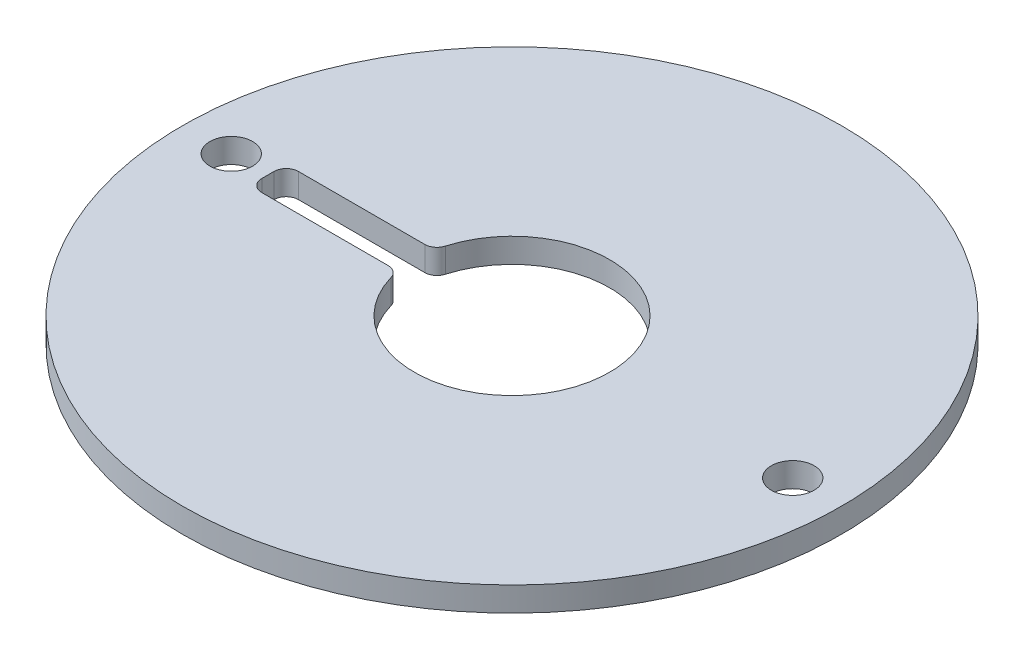
from build123d import *

# Parameters (mm, degrees)
SKETCH1_R           = 27
SKETCH1_R_2         = 8
SKETCH1_R_3         = 1.75
BOSS_EXTRUDE1_DEPTH = 2
SKETCH2_W           = 15
SKETCH2_H           = 3
CUT_EXTRUDE1_DEPTH  = 39.236108589
FILLET1_R           = 1


with BuildPart() as part:
    # Sketch1 → Boss-Extrude1 (new body)
    with BuildSketch(Plane(origin=(0, 0, 0), x_dir=(1, 0, 0), z_dir=(0, 1, 0))):
        with Locations(Location((0, 0, 0), (0, 0, 270))):
            Circle(SKETCH1_R)
        with Locations(Location((0, 0, 0), (0, 0, 270))):
            Circle(SKETCH1_R_2, mode=Mode.SUBTRACT)
        with Locations(Location((-23, 0, 0), (0, 0, 270))):
            Circle(SKETCH1_R_3, mode=Mode.SUBTRACT)
        with Locations(Location((23, 0, 0), (0, 0, 270))):
            Circle(SKETCH1_R_3, mode=Mode.SUBTRACT)
    extrude(amount=BOSS_EXTRUDE1_DEPTH)

    # Sketch2 → Cut-Extrude1 (cut, through all)
    with BuildSketch(Plane(origin=(0, 2, 0), x_dir=(1, 0, 0), z_dir=(0, 1, 0))):
        with Locations((-12.5, 0)):
            Rectangle(SKETCH2_W, SKETCH2_H)
    extrude(amount=-CUT_EXTRUDE1_DEPTH, mode=Mode.SUBTRACT)

    # Fillet1
    fillet1_edges = [part.edges().sort_by_distance(p)[0] for p in [
        (-7.858116823, 1, 1.5),
        (-7.858116823, 1, -1.5),
        (-20, 1, 1.5),
        (-20, 1, -1.5),
    ]]
    fillet(fillet1_edges, radius=FILLET1_R)


solid = part.part
